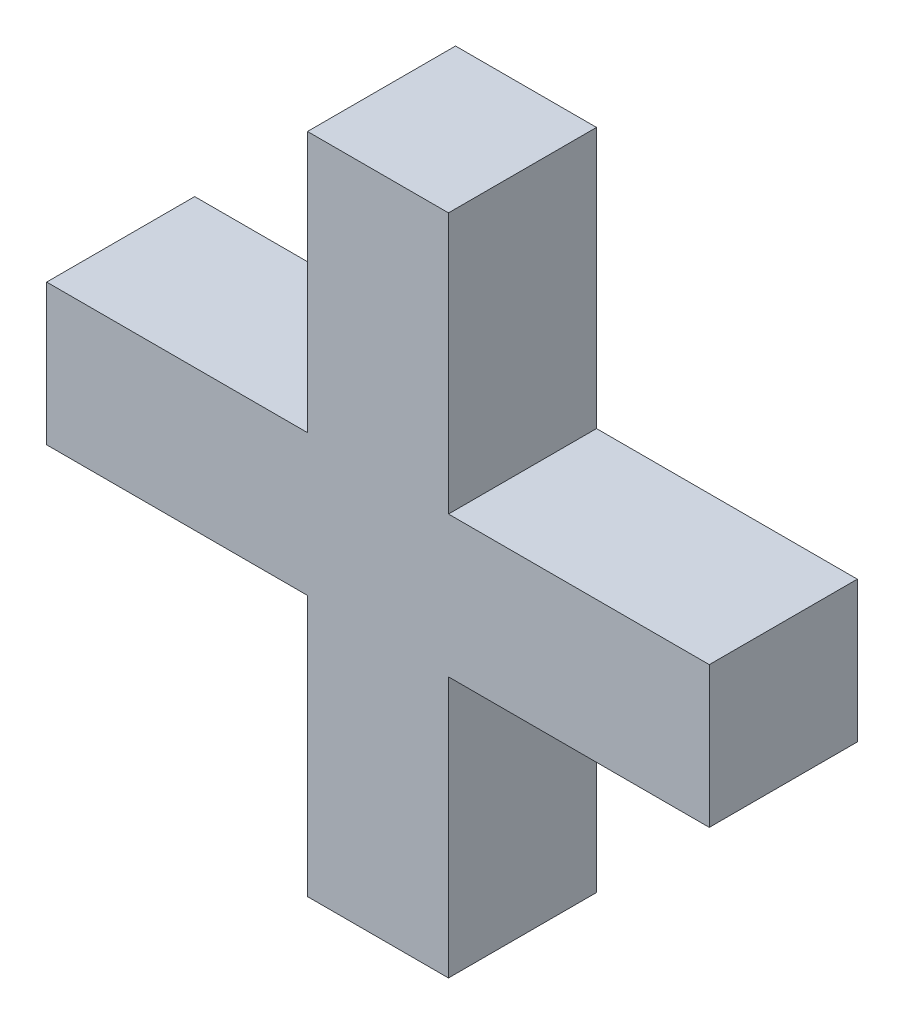
from build123d import *

# Parameters (mm, degrees)
EXTRUDE_1_DEPTH = 10.5


with BuildPart() as part:
    # Эскиз1 → Бобышка-Вытянуть1 (new body)
    with BuildSketch(Plane.XY):
        Polygon((0, 28.5), (0, 47), (10, 47), (10, 28.5), (28.5, 28.5), (28.5, 18.5), (10, 18.5), (10, 0), (0, 0), (0, 18.5), (-18.5, 18.5), (-18.5, 28.5), align=None)
    extrude(amount=EXTRUDE_1_DEPTH)


solid = part.part
